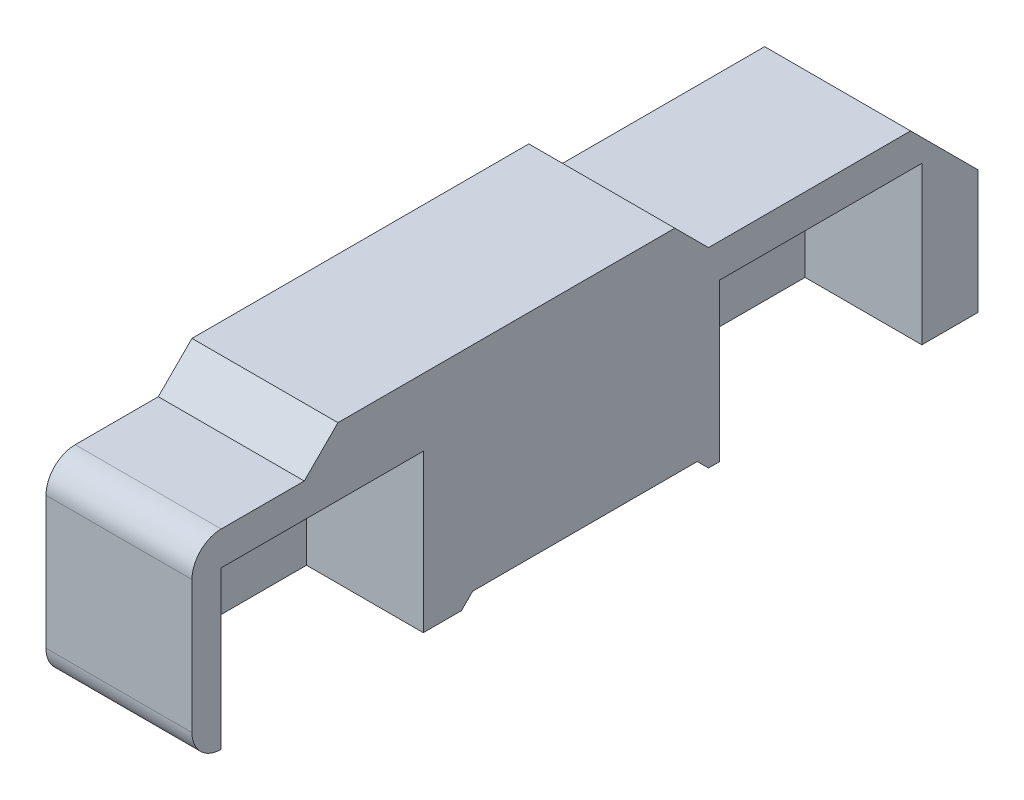
from build123d import *

# Parameters (mm, degrees)
BOSS_EXTRUDE1_DEPTH = 65
FILLET1_R           = 13
SKETCH3_W           = 90
SKETCH3_H           = 70
CUT_EXTRUDE1_DEPTH  = 52


with BuildPart() as part:
    # Sketch2 → Boss-Extrude1 (new body)
    with BuildSketch(Plane(origin=(0, 0, 0), x_dir=(0, 0, -1), z_dir=(1, 0, 0))):
        Polygon((0, 0), (0, 85), (50, 85), (65, 100), (215, 100), (230, 85), (320, 85), (350, 55), (350, 0), (230, 0), (225, 5), (125, 5), (120, 0), align=None)
    extrude(amount=BOSS_EXTRUDE1_DEPTH)

    # Fillet1
    fillet1_edges = [part.edges().sort_by_distance(p)[0] for p in [
        (32.5, 0, 0),
        (32.5, 85, 0),
    ]]
    fillet(fillet1_edges, radius=FILLET1_R)

    # Sketch3 → Cut-Extrude1 (cut)
    with BuildSketch(Plane(origin=(65, 0, 0), x_dir=(0, 0, -1), z_dir=(1, 0, 0))):
        with Locations((58, 35)):
            Rectangle(SKETCH3_W, SKETCH3_H)
        with Locations((280, 35)):
            Rectangle(SKETCH3_W, SKETCH3_H)
    extrude(amount=-CUT_EXTRUDE1_DEPTH, mode=Mode.SUBTRACT)


solid = part.part
